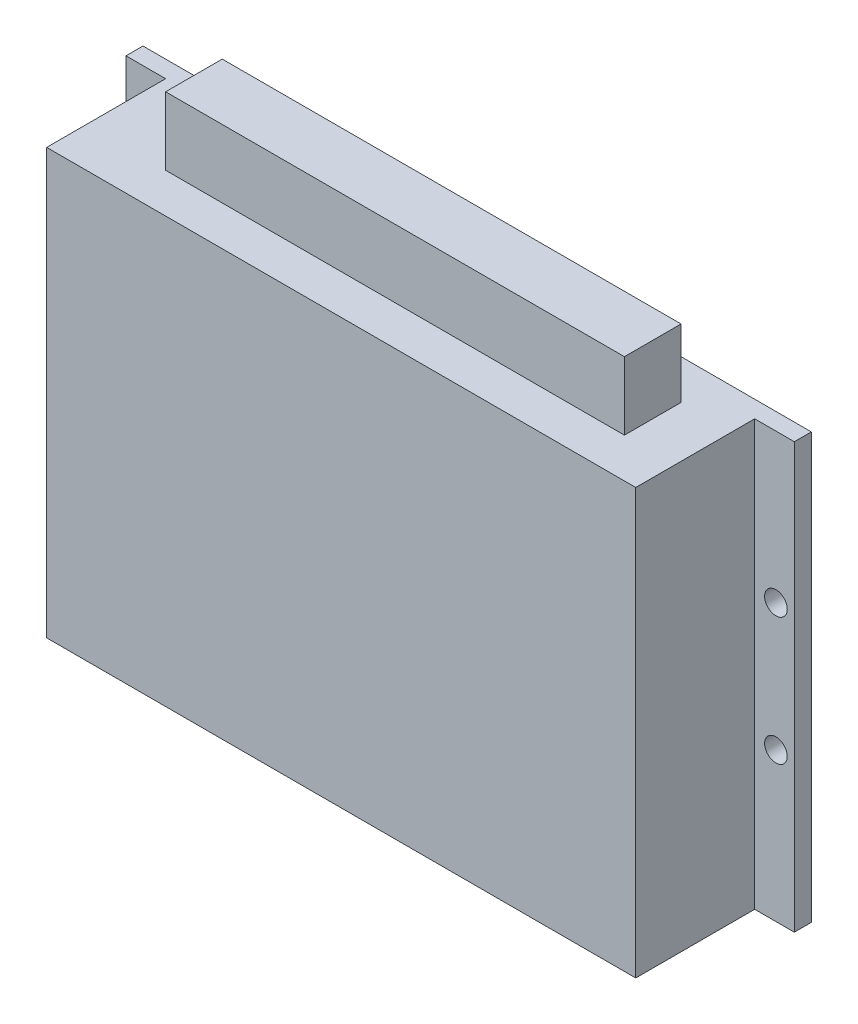
from build123d import *

# Parameters (mm, degrees)
BOSS_EXTRUDE1_DEPTH = 24
SKETCH3_W           = 7
SKETCH3_H           = 75
CUT_EXTRUDE1_DEPTH  = 21
SKETCH4_W           = 81
SKETCH4_H           = 12
CUT_EXTRUDE2_DEPTH  = 7
SKETCH5_R           = 2
CUT_EXTRUDE3_DEPTH  = 3


with BuildPart() as part:
    # Sketch2 → Boss-Extrude1 (new body)
    with BuildSketch(Plane.XY):
        Polygon((0, 0), (0, -75), (118, -75), (118, 0), (102, 0), (102, 12), (21, 12), (21, 0), align=None)
    extrude(amount=-BOSS_EXTRUDE1_DEPTH)

    # Sketch3 → Cut-Extrude1 (cut)
    with BuildSketch(Plane.XY):
        with Locations((3.5, -37.5)):
            Rectangle(SKETCH3_W, SKETCH3_H)
        with Locations((114.5, -37.5)):
            Rectangle(SKETCH3_W, SKETCH3_H)
    extrude(amount=-CUT_EXTRUDE1_DEPTH, mode=Mode.SUBTRACT)

    # Sketch4 → Cut-Extrude2 (cut)
    with BuildSketch(Plane.XY):
        with Locations((61.5, 6)):
            Rectangle(SKETCH4_W, SKETCH4_H)
    cut_extrude2 = extrude(amount=-CUT_EXTRUDE2_DEPTH, mode=Mode.SUBTRACT)

    # Mirror1: Cut-Extrude2 across plane
    add(cut_extrude2.mirror(Plane.XY.offset(-12)), mode=Mode.SUBTRACT)

    # Sketch5 → Cut-Extrude3 (cut)
    with BuildSketch(Plane(origin=(0, 0, -24), x_dir=(-1, 0, 0), z_dir=(0, 0, -1))):
        with Locations((-114.75, -26.25)):
            Circle(SKETCH5_R)
        with Locations((-114.75, -48.75)):
            Circle(SKETCH5_R)
        with Locations(Location((-3.25, -48.75, 0), (0, 0, 180))):
            Circle(SKETCH5_R)
        with Locations(Location((-3.25, -26.25, 0), (0, 0, 180))):
            Circle(SKETCH5_R)
    extrude(amount=-CUT_EXTRUDE3_DEPTH, mode=Mode.SUBTRACT)


solid = part.part
